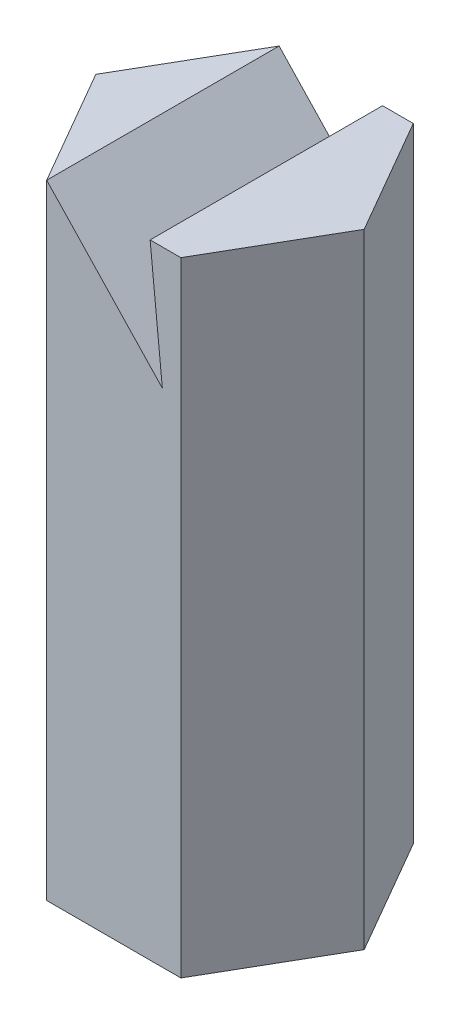
from build123d import *

# Parameters (mm, degrees)
BOSS_EXTRUDE1_DEPTH     = 51
CUT_EXTRUDE1_DEPTH      = 54.024365468
CUT_EXTRUDE1_DEPTH_BACK = 54.024365468


with BuildPart() as part:
    # Sketch1 → Boss-Extrude1 (new body)
    with BuildSketch(Plane(origin=(0, 0, 0), x_dir=(1, 0, 0), z_dir=(0, 1, 0))):
        Polygon((-5.484827557, -9.5), (5.484827557, -9.5), (10.969655115, 0), (5.484827557, 9.5), (-5.484827557, 9.5), (-10.969655115, 0), align=None)
    extrude(amount=BOSS_EXTRUDE1_DEPTH)

    # Sketch3 → Cut-Extrude1 (cut, two sides: drawn at the far end of the back side and taken through both)
    with BuildSketch(Plane.XY.offset(-CUT_EXTRUDE1_DEPTH_BACK)):
        Polygon((-5.484827557, 51), (3.969655115, 41), (2.969655115, 51), align=None)
    extrude(amount=CUT_EXTRUDE1_DEPTH + CUT_EXTRUDE1_DEPTH_BACK, mode=Mode.SUBTRACT)


solid = part.part
